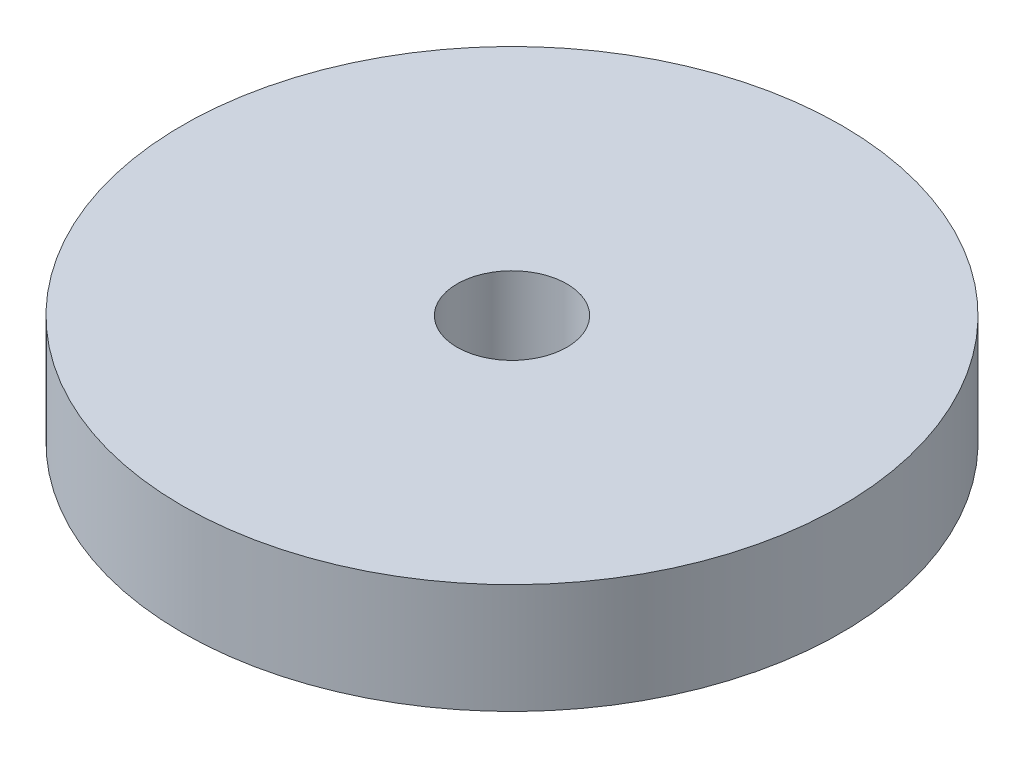
from build123d import *

# Parameters (mm, degrees)
SKETCH1_R           = 15
BOSS_EXTRUDE1_DEPTH = 5
CUT_EXTRUDE1_REACH  = 23.794
SKETCH2_R           = 2.5


with BuildPart() as part:
    # Sketch1 → Boss-Extrude1 (new body)
    with BuildSketch(Plane(origin=(0, 0, 0), x_dir=(1, 0, 0), z_dir=(0, 1, 0))):
        with Locations(Location((0, 0, 0), (0, 0, 270))):
            Circle(SKETCH1_R)
    extrude(amount=BOSS_EXTRUDE1_DEPTH)

    # Sketch2 → Cut-Extrude1 (cut, up to next)
    with BuildSketch(Plane(origin=(0, 5, 0), x_dir=(1, 0, 0), z_dir=(0, 1, 0)), mode=Mode.PRIVATE) as cut_extrude1_sk1:
        with Locations(Location((0, 0, 0), (0, 0, 270))):
            Circle(SKETCH2_R)
    cut_extrude1_tool1 = extrude(cut_extrude1_sk1.sketch, amount=-CUT_EXTRUDE1_REACH, mode=Mode.PRIVATE) & part.part
    add(cut_extrude1_tool1.solids().sort_by_distance((0, 5, 0))[0], mode=Mode.SUBTRACT)


solid = part.part
